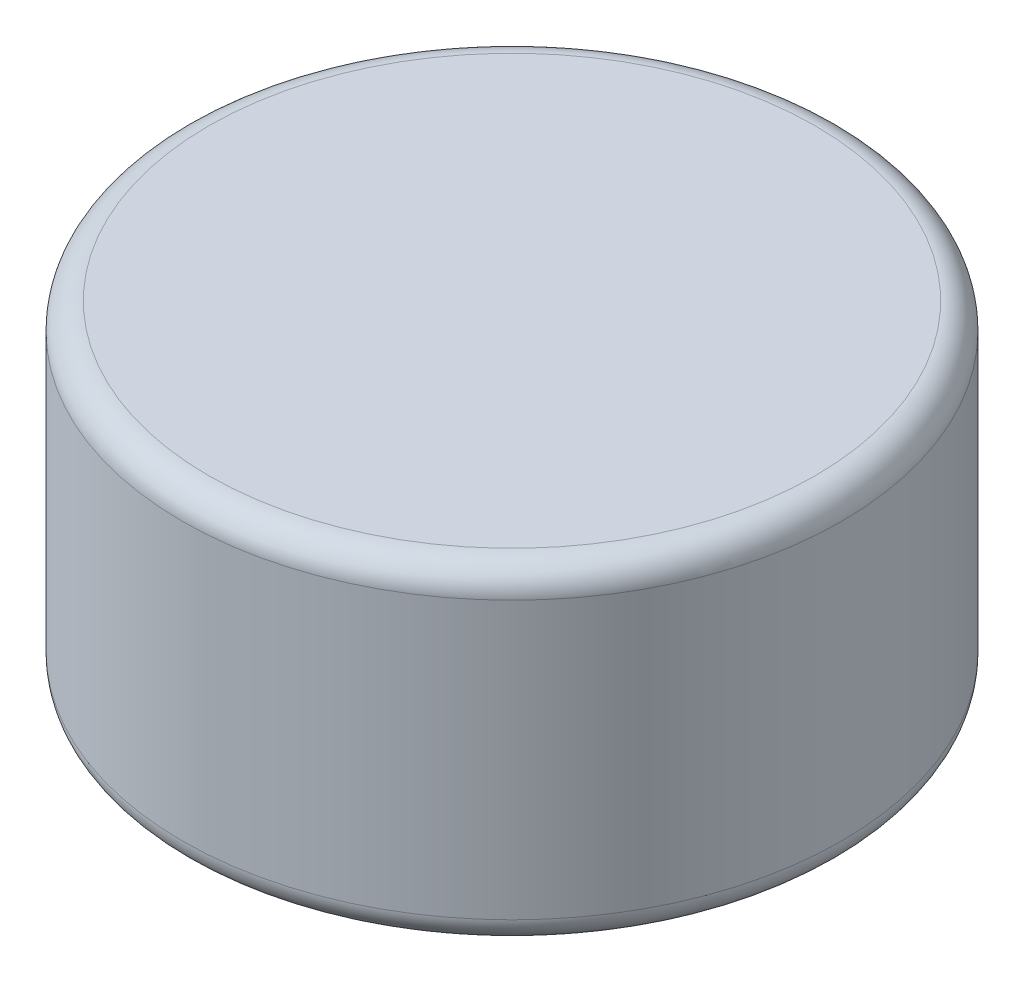
from build123d import *

# Parameters (mm, degrees)
SKETCH1_R           = 3.175
BOSS_EXTRUDE1_DEPTH = 3.175
FILLET1_R           = 0.254


with BuildPart() as part:
    # Sketch1 → Boss-Extrude1 (new body)
    with BuildSketch(Plane(origin=(0, 0, 0), x_dir=(1, 0, 0), z_dir=(0, 1, 0))):
        with Locations(Location((0, 0, 0), (0, 0, 270))):
            Circle(SKETCH1_R)
    extrude(amount=BOSS_EXTRUDE1_DEPTH)

    # Fillet1
    fillet1_edges = [part.edges().sort_by_distance(p)[0] for p in [
        (0, 0, -3.175),
        (0, 3.175, -3.175),
    ]]
    fillet(fillet1_edges, radius=FILLET1_R)


solid = part.part
